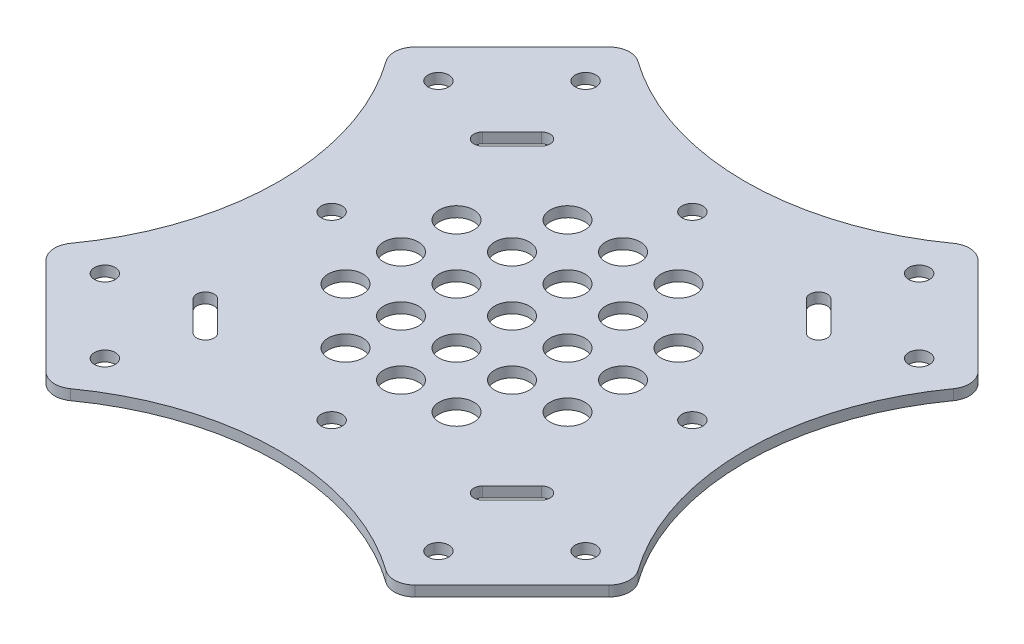
from build123d import *

# Parameters (mm, degrees)
BOSS_EXTRUDE1_DEPTH = 1.5
SKETCH2_R           = 1.5
CUT_EXTRUDE1_DEPTH  = 108.510464607
FILLET1_R           = 3
SKETCH8_R           = 2.5
CUT_EXTRUDE2_DEPTH  = 107.126175316
SKETCH9_R           = 1.5
CUT_EXTRUDE3_DEPTH  = 107.126175316


with BuildPart() as part:
    # Sketch1 → Boss-Extrude1 (new body)
    with BuildSketch(Plane(origin=(0, 0, 0), x_dir=(1, 0, 0), z_dir=(0, 1, 0))):
        with BuildLine():
            Line((76.013978978, 8.838834765), (58.336309448, -8.838834765))
            ThreePointArc((58.336309448, -8.838834765), (33.587572106, 0), (8.838834765, -8.838834765))
            Line((8.838834765, -8.838834765), (-8.838834765, 8.838834765))
            ThreePointArc((-8.838834765, 8.838834765), (0, 33.587572106), (-8.838834765, 58.336309448))
            Line((-8.838834765, 58.336309448), (8.838834765, 76.013978978))
            ThreePointArc((8.838834765, 76.013978978), (33.587572106, 67.175144213), (58.336309448, 76.013978978))
            Line((58.336309448, 76.013978978), (76.013978978, 58.336309448))
            ThreePointArc((76.013978978, 58.336309448), (67.175144213, 33.587572106), (76.013978978, 8.838834765))
        make_face()
    extrude(amount=BOSS_EXTRUDE1_DEPTH)

    # Sketch2 → Cut-Extrude1 (cut, through all)
    with BuildSketch(Plane(origin=(0, 1.5, 0), x_dir=(1, 0, 0), z_dir=(0, 1, 0))):
        with Locations(Location((57.629202667, 68.235804385, 0), (0, 0, 270))):
            Circle(SKETCH2_R)
        with Locations(Location((68.235804385, 57.629202667, 0), (0, 0, 270))):
            Circle(SKETCH2_R)
        with Locations(Location((68.235804385, 9.545941546, 0), (0, 0, 270))):
            Circle(SKETCH2_R)
        with Locations(Location((57.629202667, -1.060660172, 0), (0, 0, 270))):
            Circle(SKETCH2_R)
        with Locations(Location((9.545941546, -1.060660172, 0), (0, 0, 270))):
            Circle(SKETCH2_R)
        with Locations(Location((-1.060660172, 9.545941546, 0), (0, 0, 270))):
            Circle(SKETCH2_R)
        with Locations(Location((-1.060660172, 57.629202667, 0), (0, 0, 270))):
            Circle(SKETCH2_R)
        with Locations(Location((9.545941546, 68.235804385, 0), (0, 0, 270))):
            Circle(SKETCH2_R)
    extrude(amount=-CUT_EXTRUDE1_DEPTH, mode=Mode.SUBTRACT)

    # Fillet1
    fillet1_edges = [part.edges().sort_by_distance(p)[0] for p in [
        (76.013978978, 0.75, -8.838834765),
        (58.336309448, 0.75, 8.838834765),
        (8.838834765, 0.75, 8.838834765),
        (-8.838834765, 0.75, -8.838834765),
        (-8.838834765, 0.75, -58.336309448),
        (8.838834765, 0.75, -76.013978978),
        (58.336309448, 0.75, -76.013978978),
        (76.013978978, 0.75, -58.336309448),
    ]]
    fillet(fillet1_edges, radius=FILLET1_R)

    # Sketch8 → Cut-Extrude2 (cut, through all)
    with BuildSketch(Plane(origin=(0, 1.5, 0), x_dir=(1, 0, 0), z_dir=(0, 1, 0))):
        with Locations(Location((33.587572106, 33.587572106, 0), (0, 0, 270))):
            Circle(SKETCH8_R)
        with Locations(Location((41.587572106, 33.587572106, 0), (0, 0, 270))):
            Circle(SKETCH8_R)
        with Locations(Location((49.587572106, 33.587572106, 0), (0, 0, 270))):
            Circle(SKETCH8_R)
        with Locations(Location((41.587572106, 41.587572106, 0), (0, 0, 270))):
            Circle(SKETCH8_R)
        with Locations(Location((49.587572106, 41.587572106, 0), (0, 0, 270))):
            Circle(SKETCH8_R)
        with Locations(Location((41.587572106, 49.587572106, 0), (0, 0, 270))):
            Circle(SKETCH8_R)
        with Locations(Location((33.587572106, 41.587572106, 0), (0, 0, 270))):
            Circle(SKETCH8_R)
        with Locations(Location((33.587572106, 49.587572106, 0), (0, 0, 270))):
            Circle(SKETCH8_R)
        with Locations(Location((17.587572106, 41.587572106, 0), (0, 0, 90))):
            Circle(SKETCH8_R)
        with Locations(Location((17.587572106, 33.587572106, 0), (0, 0, 90))):
            Circle(SKETCH8_R)
        with Locations(Location((25.587572106, 33.587572106, 0), (0, 0, 90))):
            Circle(SKETCH8_R)
        with Locations(Location((25.587572106, 49.587572106, 0), (0, 0, 90))):
            Circle(SKETCH8_R)
        with Locations(Location((25.587572106, 41.587572106, 0), (0, 0, 90))):
            Circle(SKETCH8_R)
        with Locations(Location((49.587572106, 25.587572106, 0), (0, 0, 90))):
            Circle(SKETCH8_R)
        with Locations(Location((41.587572106, 17.587572106, 0), (0, 0, 90))):
            Circle(SKETCH8_R)
        with Locations(Location((41.587572106, 25.587572106, 0), (0, 0, 90))):
            Circle(SKETCH8_R)
        with Locations(Location((17.587572106, 25.587572106, 0), (0, 0, 270))):
            Circle(SKETCH8_R)
        with Locations(Location((25.587572106, 25.587572106, 0), (0, 0, 270))):
            Circle(SKETCH8_R)
        with Locations(Location((33.587572106, 25.587572106, 0), (0, 0, 90))):
            Circle(SKETCH8_R)
        with Locations(Location((33.587572106, 17.587572106, 0), (0, 0, 90))):
            Circle(SKETCH8_R)
        with Locations(Location((25.587572106, 17.587572106, 0), (0, 0, 270))):
            Circle(SKETCH8_R)
        with BuildLine():
            Line((8.485281374, 54.447222151), (12.727922061, 58.689862838))
            ThreePointArc((12.727922061, 58.689862838), (14.495689014, 58.689862838), (14.495689014, 56.922095886))
            Line((14.495689014, 56.922095886), (10.253048327, 52.679455198))
            ThreePointArc((10.253048327, 52.679455198), (8.485281374, 52.679455198), (8.485281374, 54.447222151))
        make_face()
        with BuildLine():
            Line((54.447222151, 58.689862838), (58.689862838, 54.447222151))
            ThreePointArc((58.689862838, 54.447222151), (58.689862838, 52.679455198), (56.922095886, 52.679455198))
            Line((56.922095886, 52.679455198), (52.679455198, 56.922095886))
            ThreePointArc((52.679455198, 56.922095886), (52.679455198, 58.689862838), (54.447222151, 58.689862838))
        make_face()
        with BuildLine():
            Line((58.689862838, 12.727922061), (54.447222151, 8.485281374))
            ThreePointArc((54.447222151, 8.485281374), (52.679455198, 8.485281374), (52.679455198, 10.253048327))
            Line((52.679455198, 10.253048327), (56.922095886, 14.495689014))
            ThreePointArc((56.922095886, 14.495689014), (58.689862838, 14.495689014), (58.689862838, 12.727922061))
        make_face()
        with BuildLine():
            Line((12.727922061, 8.485281374), (8.485281374, 12.727922061))
            ThreePointArc((8.485281374, 12.727922061), (8.485281374, 14.495689014), (10.253048327, 14.495689014))
            Line((10.253048327, 14.495689014), (14.495689014, 10.253048327))
            ThreePointArc((14.495689014, 10.253048327), (14.495689014, 8.485281374), (12.727922061, 8.485281374))
        make_face()
    extrude(amount=-CUT_EXTRUDE2_DEPTH, mode=Mode.SUBTRACT)

    # Sketch9 → Cut-Extrude3 (cut, through all)
    with BuildSketch(Plane(origin=(0, 1.5, 0), x_dir=(1, 0, 0), z_dir=(0, 1, 0))):
        with Locations(Location((33.587572106, 59.587572106, 0), (0, 0, 270))):
            Circle(SKETCH9_R)
        with Locations(Location((59.587572106, 33.587572106, 0), (0, 0, 270))):
            Circle(SKETCH9_R)
        with Locations(Location((33.587572106, 7.587572106, 0), (0, 0, 270))):
            Circle(SKETCH9_R)
        with Locations(Location((7.587572106, 33.587572106, 0), (0, 0, 270))):
            Circle(SKETCH9_R)
    extrude(amount=-CUT_EXTRUDE3_DEPTH, mode=Mode.SUBTRACT)


solid = part.part
